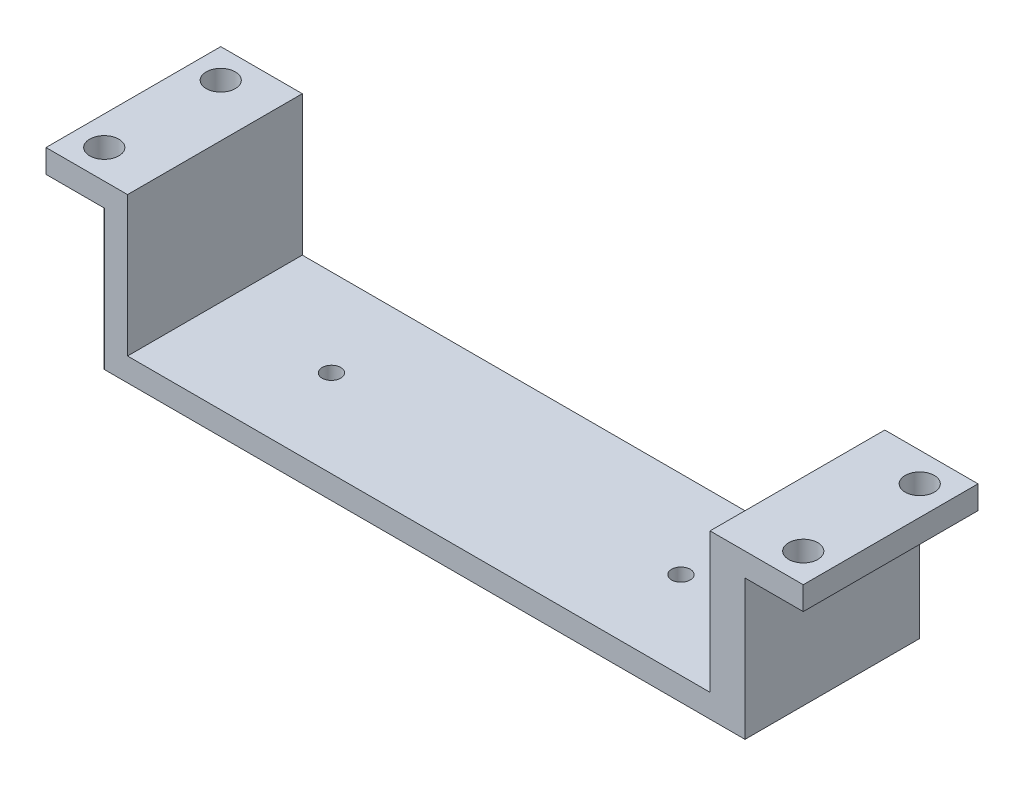
from build123d import *

# Parameters (mm, degrees)
SKETCH_1_W      = 50
SKETCH_1_H      = 15
SKETCH_1_R      = 0.8
EXTRUDE_2_DEPTH = 2
SKETCH_1_5_W    = 2
SKETCH_1_5_H    = 15
SKETCH_1_5_W_2  = 3
EXTRUDE_3_DEPTH = 14
EXTRUDE_START   = 14
SKETCH_1_6_R    = 1.25
EXTRUDE_4_DEPTH = 2


with BuildPart() as part:
    # 草图1 → 凸台-拉伸2 (new body)
    with BuildSketch(Plane(origin=(0, 0, 0), x_dir=(1, 0, 0), z_dir=(0, 1, 0))):
        with Locations((25, -7.5)):
            Rectangle(SKETCH_1_W, SKETCH_1_H)
        with Locations(Location((10, -7.5, 0), (0, 0, 270))):
            Circle(SKETCH_1_R, mode=Mode.SUBTRACT)
        with Locations(Location((40, -7.5, 0), (0, 0, 270))):
            Circle(SKETCH_1_R, mode=Mode.SUBTRACT)
    extrude(amount=EXTRUDE_2_DEPTH)

    # 草图1<5> → 凸台-拉伸3 (add)
    with BuildSketch(Plane(origin=(0, 0, 0), x_dir=(1, 0, 0), z_dir=(0, 1, 0))):
        with Locations((-1, -7.5)):
            Rectangle(SKETCH_1_5_W, SKETCH_1_5_H)
        with Locations((51.5, -7.5)):
            Rectangle(SKETCH_1_5_W_2, SKETCH_1_5_H)
    extrude(amount=EXTRUDE_3_DEPTH)

    # 草图1<6> → 凸台-拉伸4 (add)
    # profile 1 of 2: a face of its own
    with BuildSketch(Plane(origin=(0, 0, 0), x_dir=(1, 0, 0), z_dir=(0, 1, 0)).offset(EXTRUDE_START)):
        Polygon((-2, 0), (-4.5, 0), (-7, 0), (-7, -15), (-4.5, -15), (-2, -15), align=None)
        with Locations(Location((-4.5, -12.5, 0), (0, 0, 270))):
            Circle(SKETCH_1_6_R, mode=Mode.SUBTRACT)
        with Locations(Location((-4.5, -2.5, 0), (0, 0, 270))):
            Circle(SKETCH_1_6_R, mode=Mode.SUBTRACT)
    # profile 2 of 2: a face of its own
    with BuildSketch(Plane(origin=(0, 0, 0), x_dir=(1, 0, 0), z_dir=(0, 1, 0)).offset(EXTRUDE_START)):
        Polygon((55.5, 0), (53, 0), (53, -15), (58, -15), (58, 0), align=None)
        with Locations(Location((55.5, -12.5, 0), (0, 0, 270))):
            Circle(SKETCH_1_6_R, mode=Mode.SUBTRACT)
        with Locations(Location((55.5, -2.5, 0), (0, 0, 270))):
            Circle(SKETCH_1_6_R, mode=Mode.SUBTRACT)
    extrude(amount=-EXTRUDE_4_DEPTH)


solid = part.part
